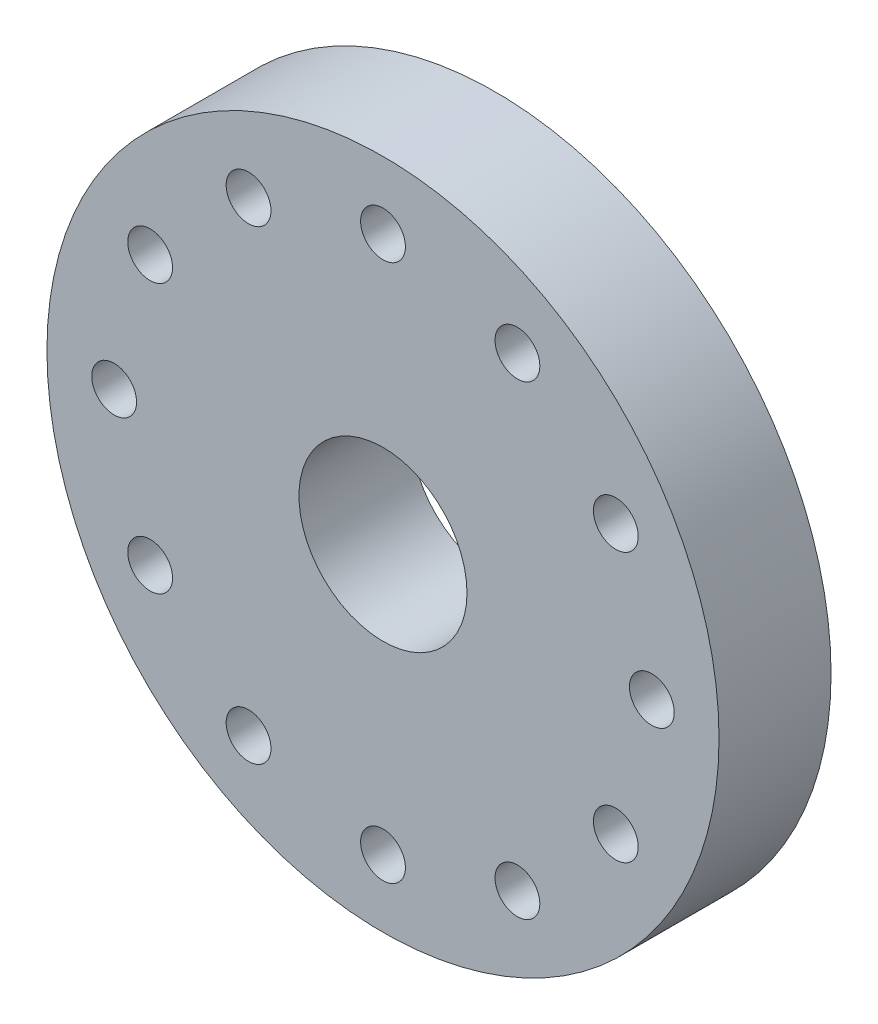
from build123d import *

# Parameters (mm, degrees)
SKETCH_1_R          = 30
EXTRUDE_1_DEPTH     = 10
SKETCH_2_R          = 7.5
CUT_EXTRUDE_1_DEPTH = 44.588989435
SKETCH_3_R          = 2
CUT_EXTRUDE_2_DEPTH = 44.588989435


with BuildPart() as part:
    # 草图1 → 凸台-拉伸1 (new body)
    with BuildSketch(Plane.XY):
        Circle(SKETCH_1_R)
    extrude(amount=EXTRUDE_1_DEPTH)

    # 草图2 → 切除-拉伸1 (cut, through all)
    with BuildSketch(Plane.XY):
        Circle(SKETCH_2_R)
    extrude(amount=CUT_EXTRUDE_1_DEPTH, mode=Mode.SUBTRACT)

    # 草图3 → 切除-拉伸2 (cut, through all)
    with BuildSketch(Plane.XY):
        with Locations((24, 0)):
            Circle(SKETCH_3_R)
        with Locations((20.78461, 12)):
            Circle(SKETCH_3_R)
        with Locations((12, 20.78461)):
            Circle(SKETCH_3_R)
        with Locations((0, 24)):
            Circle(SKETCH_3_R)
        with Locations((-12, 20.78461)):
            Circle(SKETCH_3_R)
        with Locations((-20.78461, 12)):
            Circle(SKETCH_3_R)
        with Locations((-24, 0)):
            Circle(SKETCH_3_R)
        with Locations((-20.78461, -12)):
            Circle(SKETCH_3_R)
        with Locations((-12, -20.78461)):
            Circle(SKETCH_3_R)
        with Locations((0, -24)):
            Circle(SKETCH_3_R)
        with Locations((12, -20.78461)):
            Circle(SKETCH_3_R)
        with Locations((20.78461, -12)):
            Circle(SKETCH_3_R)
    extrude(amount=CUT_EXTRUDE_2_DEPTH, mode=Mode.SUBTRACT)


solid = part.part
